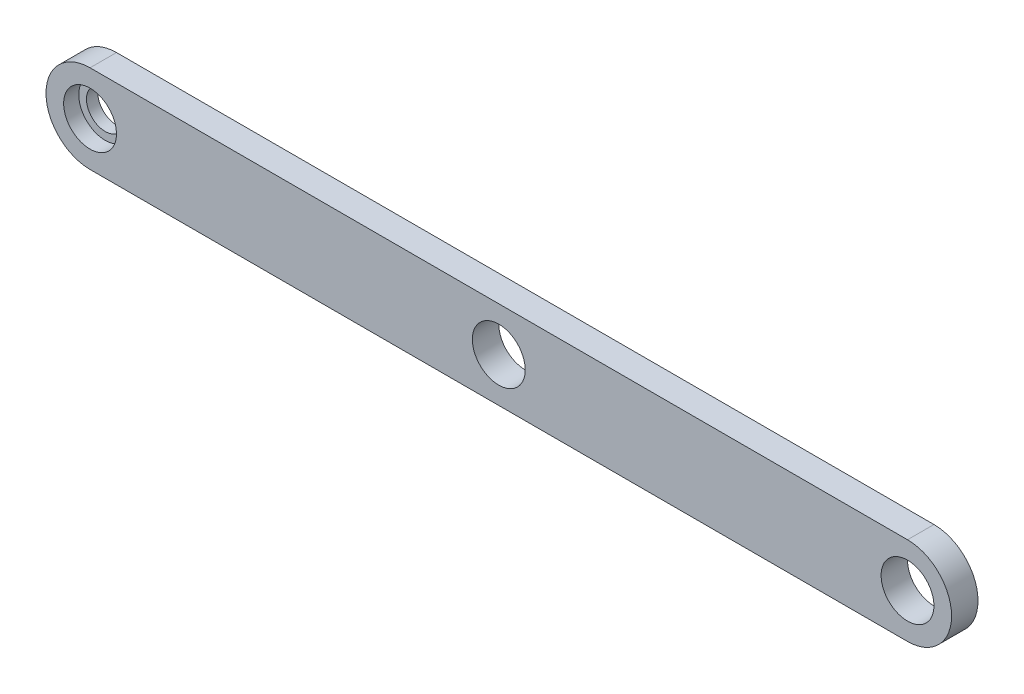
from build123d import *

# Parameters (mm, degrees)
SKETCH1_R           = 4.7625
BOSS_EXTRUDE1_DEPTH = 4.7625
SKETCH1_2_R         = 4.7625
SKETCH1_2_R_2       = 3.3734375
BOSS_EXTRUDE2_DEPTH = 2.032


with BuildPart() as part:
    # Sketch1 → Boss-Extrude1 (new body)
    with BuildSketch(Plane.XY):
        with BuildLine():
            Line((73.66, 7.9375), (-73.66, 7.9375))
            ThreePointArc((-73.66, 7.9375), (-81.5975, 0), (-73.66, -7.9375))
            Line((-73.66, -7.9375), (73.66, -7.9375))
            ThreePointArc((73.66, -7.9375), (81.5975, 0), (73.66, 7.9375))
        make_face()
        Circle(SKETCH1_R, mode=Mode.SUBTRACT)
        with Locations((-73.66, 0)):
            Circle(SKETCH1_R, mode=Mode.SUBTRACT)
        with Locations((73.66, 0)):
            Circle(SKETCH1_R, mode=Mode.SUBTRACT)
    extrude(amount=BOSS_EXTRUDE1_DEPTH)

    # Sketch1<2> → Boss-Extrude2 (add)
    with BuildSketch(Plane.XY):
        with Locations((-73.66, 0)):
            Circle(SKETCH1_2_R)
        with Locations((-73.66, 0)):
            Circle(SKETCH1_2_R_2, mode=Mode.SUBTRACT)
    extrude(amount=BOSS_EXTRUDE2_DEPTH)


solid = part.part
